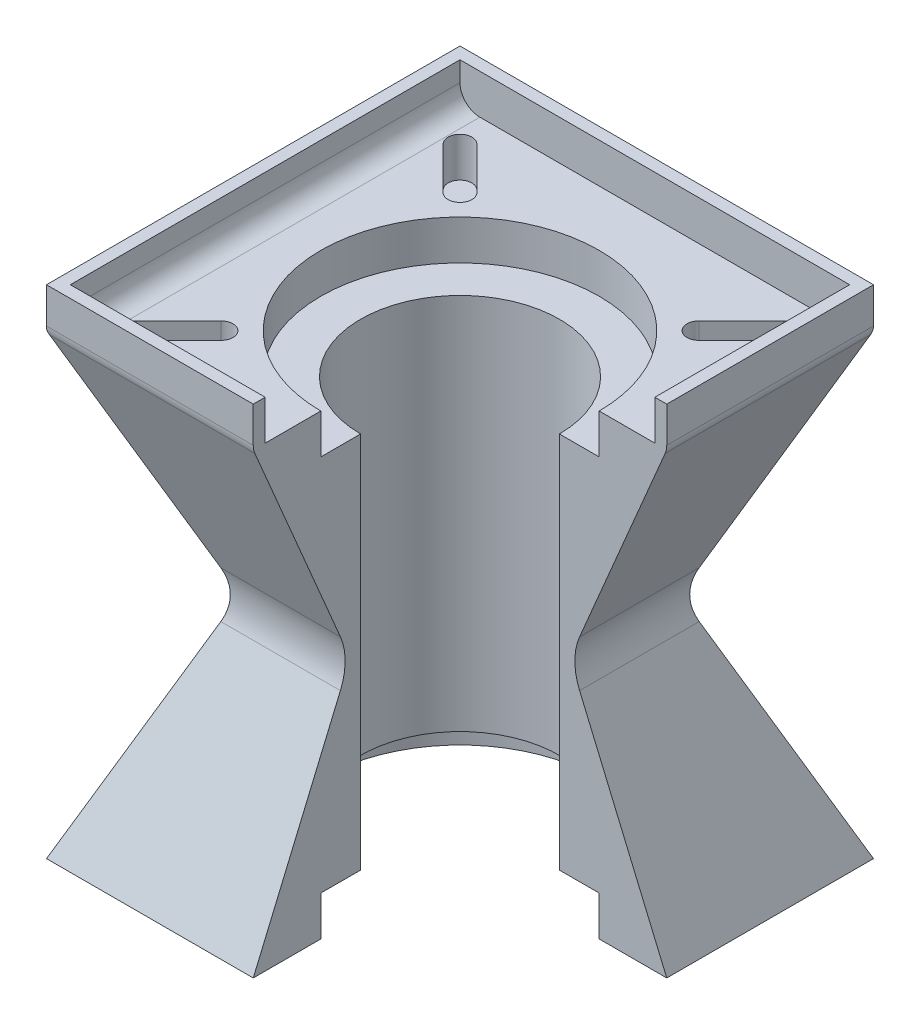
from build123d import *

# Parameters (mm, degrees)
SKETCH1_W           = 104
SKETCH1_H           = 104
BOSS_EXTRUDE1_DEPTH = 57.5
CUT_EXTRUDE1_DEPTH  = 104
CUT_EXTRUDE2_DEPTH  = 104
SKETCH4_R           = 25
CUT_EXTRUDE3_DEPTH  = 115
SKETCH5_R           = 35
SKETCH5_R_2         = 25
CUT_EXTRUDE4_DEPTH  = 10
CUT_EXTRUDE5_START  = -10
SKETCH6_R           = 35
CUT_EXTRUDE5_DEPTH  = 10
SKETCH7_W           = 52
SKETCH7_H           = 52
CUT_EXTRUDE6_DEPTH  = 115
FILLET1_R           = 15
BOSS_EXTRUDE2_DEPTH = 10
CUT_EXTRUDE7_DEPTH  = 10
FILLET2_R           = 5


with BuildPart() as part:
    # Sketch1 → Boss-Extrude1 (new, symmetric)
    with BuildSketch(Plane(origin=(0, 0, 0), x_dir=(1, 0, 0), z_dir=(0, 1, 0))):
        with Locations((52, 52)):
            Rectangle(SKETCH1_W, SKETCH1_H)
    extrude(amount=BOSS_EXTRUDE1_DEPTH, both=True)

    # Sketch2 → Cut-Extrude1 (cut)
    with BuildSketch(Plane.XY):
        Polygon((0, -57.5), (24.407301932, 0), (0, 57.5), align=None)
        Polygon((104, 57.5), (79.592698068, 0), (104, -57.5), align=None)
    extrude(amount=-CUT_EXTRUDE1_DEPTH, mode=Mode.SUBTRACT)

    # Sketch3 → Cut-Extrude2 (cut)
    with BuildSketch(Plane.ZY.offset(-104)):
        Polygon((-104, 57.5), (-79.592698068, 0), (-104, -57.5), align=None)
        Polygon((0, 57.5), (-24.407301932, 0), (0, -57.5), align=None)
    extrude(amount=CUT_EXTRUDE2_DEPTH, mode=Mode.SUBTRACT)

    # Sketch4 → Cut-Extrude3 (cut)
    with BuildSketch(Plane(origin=(0, 57.5, 0), x_dir=(1, 0, 0), z_dir=(0, 1, 0))):
        with Locations(Location((52, 52, 0), (0, 0, 270))):
            Circle(SKETCH4_R)
    extrude(amount=-CUT_EXTRUDE3_DEPTH, mode=Mode.SUBTRACT)

    # Sketch5 → Cut-Extrude4 (cut)
    with BuildSketch(Plane(origin=(0, 57.5, 0), x_dir=(1, 0, 0), z_dir=(0, 1, 0))):
        with Locations(Location((52, 52, 0), (0, 0, 270))):
            Circle(SKETCH5_R)
        with Locations(Location((52, 52, 0), (0, 0, 270))):
            Circle(SKETCH5_R_2, mode=Mode.SUBTRACT)
    extrude(amount=-CUT_EXTRUDE4_DEPTH, mode=Mode.SUBTRACT)

    # Sketch6 → Cut-Extrude5 (cut)
    with BuildSketch(Plane.XZ.offset(57.5).offset(CUT_EXTRUDE5_START)):
        with Locations(Location((52, -52, 0), (0, 0, 90))):
            Circle(SKETCH6_R)
    extrude(amount=CUT_EXTRUDE5_DEPTH, mode=Mode.SUBTRACT)

    # Sketch7 → Cut-Extrude6 (cut)
    with BuildSketch(Plane(origin=(0, 57.5, 0), x_dir=(1, 0, 0), z_dir=(0, 1, 0))):
        with Locations((78, 26)):
            Rectangle(SKETCH7_W, SKETCH7_H)
    extrude(amount=-CUT_EXTRUDE6_DEPTH, mode=Mode.SUBTRACT)

    # Fillet1
    fillet1_edges = [part.edges().sort_by_distance(p)[0] for p in [
        (24.407301932, 0, -52),
        (79.592698068, 0, -65.796349034),
        (52, 0, -79.592698068),
        (38.203650966, 0, -24.407301932),
    ]]
    fillet(fillet1_edges, radius=FILLET1_R)

    # Sketch8 → Boss-Extrude2 (add)
    with BuildSketch(Plane(origin=(0, 57.5, 0), x_dir=(1, 0, 0), z_dir=(0, 1, 0))):
        Polygon((101, 101), (101, 52), (104, 52), (104, 104), (0, 104), (0, 0), (52, 0), (52, 3), (3, 3), (3, 101), align=None)
    extrude(amount=BOSS_EXTRUDE2_DEPTH)

    # Sketch9 → Cut-Extrude7 (cut)
    with BuildSketch(Plane(origin=(0, 57.5, 0), x_dir=(1, 0, 0), z_dir=(0, 1, 0))):
        with BuildLine():
            Line((13.462680425, 94.779960262), (24.069282143, 84.173358544))
            ThreePointArc((24.069282143, 84.173358544), (24.069282143, 79.930717857), (19.826641456, 79.930717857))
            Line((19.826641456, 79.930717857), (9.220039738, 90.537319575))
            ThreePointArc((9.220039738, 90.537319575), (9.220039738, 94.779960262), (13.462680425, 94.779960262))
        make_face()
        with BuildLine():
            Line((94.779960262, 90.537319575), (84.173358544, 79.930717857))
            ThreePointArc((84.173358544, 79.930717857), (79.930717857, 79.930717857), (79.930717857, 84.173358544))
            Line((79.930717857, 84.173358544), (90.537319575, 94.779960262))
            ThreePointArc((90.537319575, 94.779960262), (94.779960262, 94.779960262), (94.779960262, 90.537319575))
        make_face()
        with BuildLine():
            Line((24.069282143, 19.826641456), (13.462680425, 9.220039738))
            ThreePointArc((13.462680425, 9.220039738), (9.220039738, 9.220039738), (9.220039738, 13.462680425))
            Line((9.220039738, 13.462680425), (19.826641456, 24.069282143))
            ThreePointArc((19.826641456, 24.069282143), (24.069282143, 24.069282143), (24.069282143, 19.826641456))
        make_face()
    extrude(amount=-CUT_EXTRUDE7_DEPTH, mode=Mode.SUBTRACT)

    # Fillet2
    fillet2_edges = [part.edges().sort_by_distance(p)[0] for p in [
        (104, 57.5, -78),
        (3, 57.5, -52),
        (52, 57.5, -104),
        (26, 57.5, 0),
    ]]
    fillet(fillet2_edges, radius=FILLET2_R)


solid = part.part
